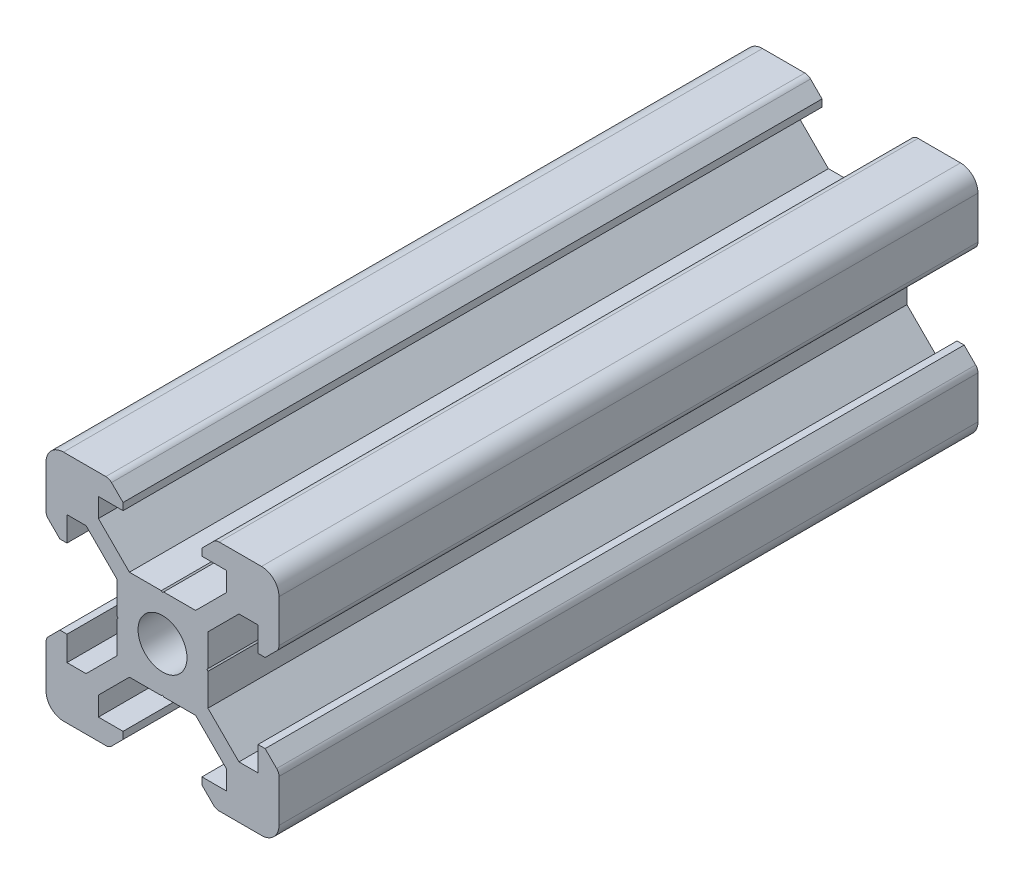
from build123d import *

# Parameters (mm, degrees)
SKETCH1_R           = 2.1
BOSS_EXTRUDE1_DEPTH = 60


with BuildPart() as part:
    # Sketch1 → Boss-Extrude1 (new body)
    with BuildSketch(Plane.XY):
        with BuildLine():
            Line((-8.5, 10), (-4.862792737, 10))
            ThreePointArc((-4.862792737, 10), (-4.598292737, 9.947387679), (-4.374060464, 9.797560464))
            Line((-4.374060464, 9.797560464), (-3.3865, 8.81))
            Line((-3.3865, 8.81), (-3.3865, 8.2))
            Line((-3.3865, 8.2), (-5.5, 8.2))
            Line((-5.5, 8.2), (-5.5, 6.561))
            Line((-5.5, 6.561), (-2.8395, 3.9005))
            Line((-2.8395, 3.9005), (-0.1, 3.9005))
            Line((-0.1, 3.9005), (0, 3.8005))
            Line((0, 3.8005), (0.1, 3.9005))
            Line((0.1, 3.9005), (2.8395, 3.9005))
            Line((2.8395, 3.9005), (5.5, 6.561))
            Line((5.5, 6.561), (5.5, 8.2))
            Line((5.5, 8.2), (3.3865, 8.2))
            Line((3.3865, 8.2), (3.3865, 8.81))
            Line((3.3865, 8.81), (4.374060464, 9.797560464))
            ThreePointArc((4.374060464, 9.797560464), (4.598292737, 9.947387679), (4.862792737, 10))
            Line((4.862792737, 10), (8.5, 10))
            ThreePointArc((8.5, 10), (9.560660172, 9.560660172), (10, 8.5))
            Line((10, 8.5), (10, 4.862792737))
            ThreePointArc((10, 4.862792737), (9.947387679, 4.598292737), (9.797560464, 4.374060464))
            Line((9.797560464, 4.374060464), (8.81, 3.3865))
            Line((8.81, 3.3865), (8.2, 3.3865))
            Line((8.2, 3.3865), (8.2, 5.5))
            Line((8.2, 5.5), (6.561, 5.5))
            Line((6.561, 5.5), (3.9005, 2.8395))
            Line((3.9005, 2.8395), (3.9005, 0.1))
            Line((3.9005, 0.1), (3.8005, 0))
            Line((3.8005, 0), (3.9005, -0.1))
            Line((3.9005, -0.1), (3.9005, -2.8395))
            Line((3.9005, -2.8395), (6.561, -5.5))
            Line((6.561, -5.5), (8.2, -5.5))
            Line((8.2, -5.5), (8.2, -3.3865))
            Line((8.2, -3.3865), (8.81, -3.3865))
            Line((8.81, -3.3865), (9.797560464, -4.374060464))
            ThreePointArc((9.797560464, -4.374060464), (9.947387679, -4.598292737), (10, -4.862792737))
            Line((10, -4.862792737), (10, -8.5))
            ThreePointArc((10, -8.5), (9.560660172, -9.560660172), (8.5, -10))
            Line((8.5, -10), (4.862792737, -10))
            ThreePointArc((4.862792737, -10), (4.598292737, -9.947387679), (4.374060464, -9.797560464))
            Line((4.374060464, -9.797560464), (3.3865, -8.81))
            Line((3.3865, -8.81), (3.3865, -8.2))
            Line((3.3865, -8.2), (5.5, -8.2))
            Line((5.5, -8.2), (5.5, -6.561))
            Line((5.5, -6.561), (2.8395, -3.9005))
            Line((2.8395, -3.9005), (0.1, -3.9005))
            Line((0.1, -3.9005), (0, -3.8005))
            Line((0, -3.8005), (-0.1, -3.9005))
            Line((-0.1, -3.9005), (-2.8395, -3.9005))
            Line((-2.8395, -3.9005), (-5.5, -6.561))
            Line((-5.5, -6.561), (-5.5, -8.2))
            Line((-5.5, -8.2), (-3.3865, -8.2))
            Line((-3.3865, -8.2), (-3.3865, -8.81))
            Line((-3.3865, -8.81), (-4.374060464, -9.797560464))
            ThreePointArc((-4.374060464, -9.797560464), (-4.598292737, -9.947387679), (-4.862792737, -10))
            Line((-4.862792737, -10), (-8.5, -10))
            ThreePointArc((-8.5, -10), (-9.560660172, -9.560660172), (-10, -8.5))
            Line((-10, -8.5), (-10, -4.862792737))
            ThreePointArc((-10, -4.862792737), (-9.947387679, -4.598292737), (-9.797560464, -4.374060464))
            Line((-9.797560464, -4.374060464), (-8.81, -3.3865))
            Line((-8.81, -3.3865), (-8.2, -3.3865))
            Line((-8.2, -3.3865), (-8.2, -5.5))
            Line((-8.2, -5.5), (-6.561, -5.5))
            Line((-6.561, -5.5), (-3.9005, -2.8395))
            Line((-3.9005, -2.8395), (-3.9005, -0.1))
            Line((-3.9005, -0.1), (-3.8005, 0))
            Line((-3.8005, 0), (-3.9005, 0.1))
            Line((-3.9005, 0.1), (-3.9005, 2.8395))
            Line((-3.9005, 2.8395), (-6.561, 5.5))
            Line((-6.561, 5.5), (-8.2, 5.5))
            Line((-8.2, 5.5), (-8.2, 3.3865))
            Line((-8.2, 3.3865), (-8.81, 3.3865))
            Line((-8.81, 3.3865), (-9.797560464, 4.374060464))
            ThreePointArc((-9.797560464, 4.374060464), (-9.947387679, 4.598292737), (-10, 4.862792737))
            Line((-10, 4.862792737), (-10, 8.5))
            ThreePointArc((-10, 8.5), (-9.560660172, 9.560660172), (-8.5, 10))
        make_face()
        Circle(SKETCH1_R, mode=Mode.SUBTRACT)
    extrude(amount=BOSS_EXTRUDE1_DEPTH)


solid = part.part
